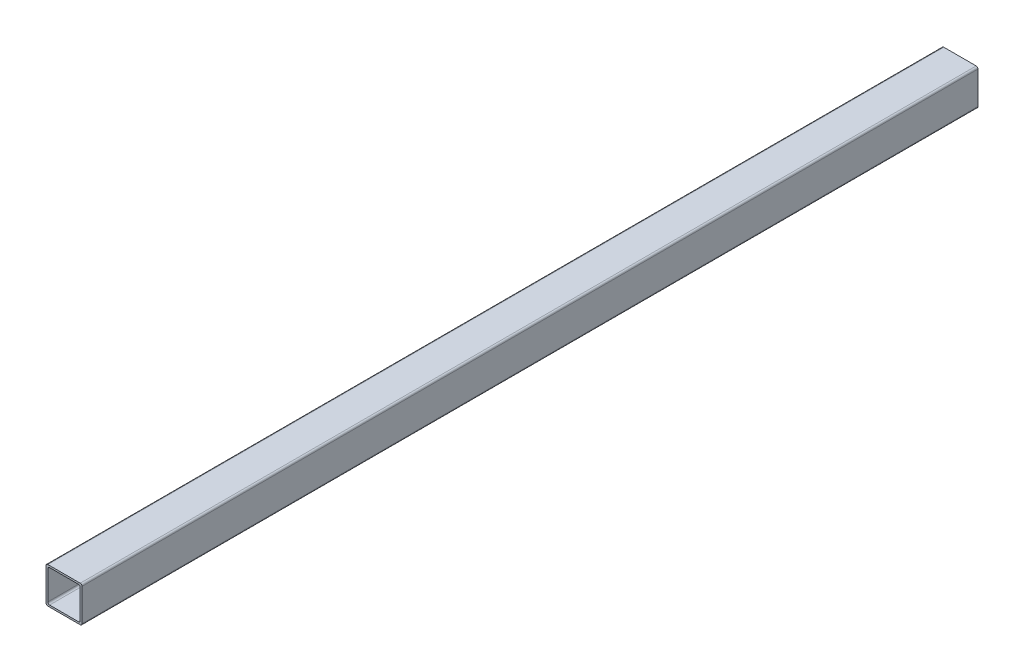
from build123d import *

# Parameters (mm, degrees)
EXTRUDE_1_DEPTH = 995


with BuildPart() as part:
    # Эскиз1 → Бобышка-Вытянуть1 (new body)
    with BuildSketch(Plane.XY):
        with BuildLine():
            Line((-18, 20), (18, 20))
            ThreePointArc((18, 20), (19.414213562, 19.414213562), (20, 18))
            Line((20, 18), (20, -18))
            ThreePointArc((20, -18), (19.414213562, -19.414213562), (18, -20))
            Line((18, -20), (-18, -20))
            ThreePointArc((-18, -20), (-19.414213562, -19.414213562), (-20, -18))
            Line((-20, -18), (-20, 18))
            ThreePointArc((-20, 18), (-19.414213562, 19.414213562), (-18, 20))
        make_face()
        with BuildLine():
            Line((16, -18), (-16, -18))
            ThreePointArc((-16, -18), (-17.414213562, -17.414213562), (-18, -16))
            Line((-18, -16), (-18, 16))
            ThreePointArc((-18, 16), (-17.414213562, 17.414213562), (-16, 18))
            Line((-16, 18), (16, 18))
            ThreePointArc((16, 18), (17.414213562, 17.414213562), (18, 16))
            Line((18, 16), (18, -16))
            ThreePointArc((18, -16), (17.414213562, -17.414213562), (16, -18))
        make_face(mode=Mode.SUBTRACT)
    extrude(amount=EXTRUDE_1_DEPTH)


solid = part.part
